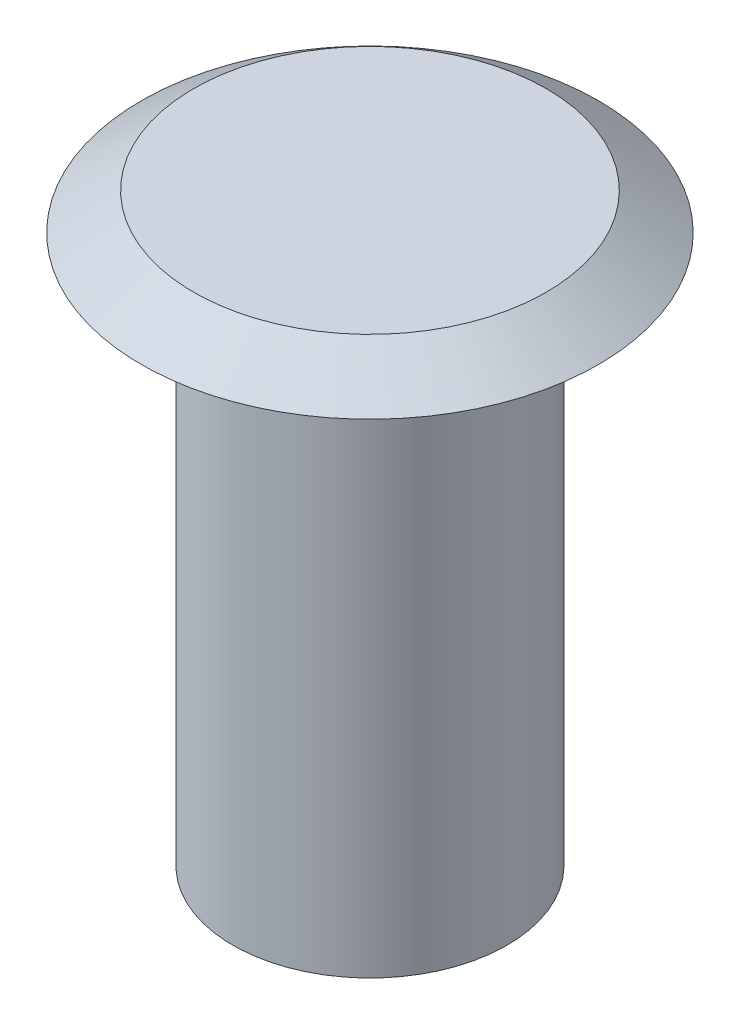
from build123d import *


with BuildPart() as part:
    # 草图1 → 旋转1 (revolve)
    with BuildSketch(Plane.XY, mode=Mode.PRIVATE) as revolve_1_sk:
        Polygon((0, 6.4), (-1.928740797, 6.4), (-2.5, 6), (-1.5, 6), (-1.5, 0), (-0.6, 0), (-0.6, 4), (0, 4), align=None)
    revolve(revolve_1_sk.sketch.rotate(Axis((0, 0, 0), (0, 1, 0)), 270), axis=Axis((0, 0, 0), (0, 1, 0)))


solid = part.part
